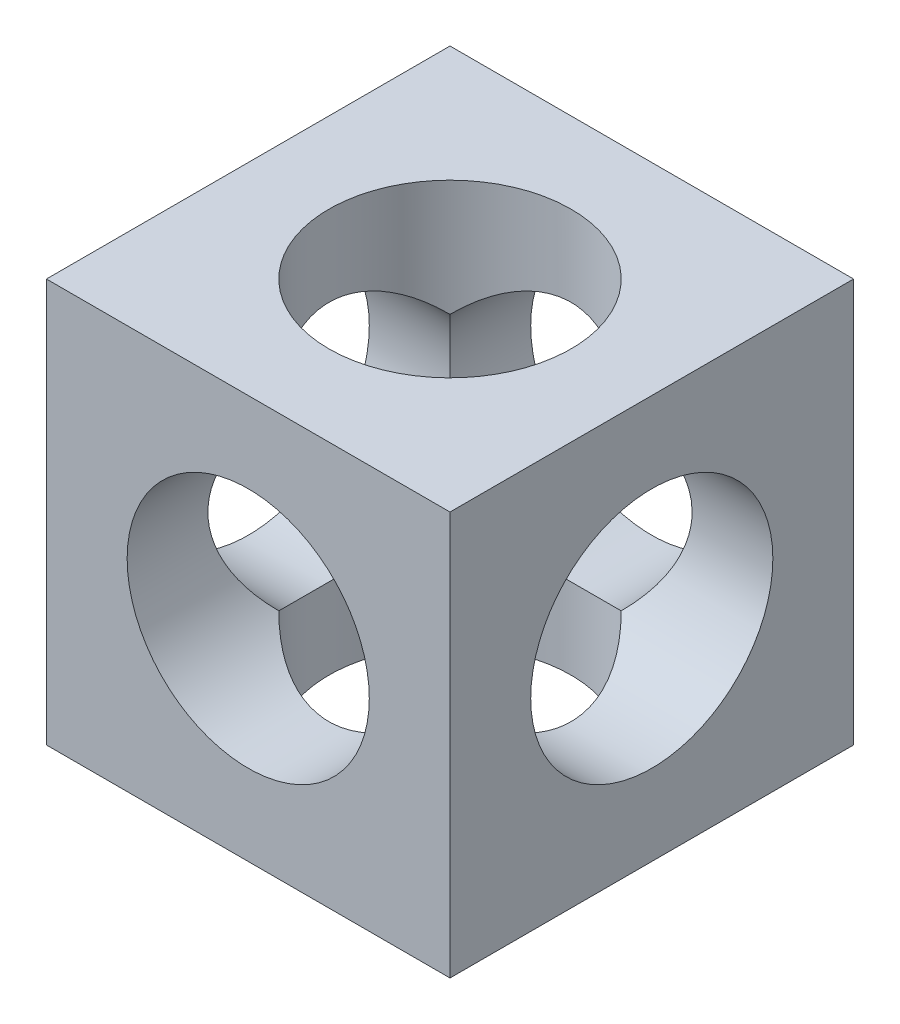
from build123d import *

# Parameters (mm, degrees)
SKETCH_1_W          = 5
SKETCH_1_H          = 5
SKETCH_1_R          = 1.5
EXTRUDE_1_DEPTH     = 5
SKETCH_2_R          = 1.5
CUT_EXTRUDE_1_DEPTH = 5
SKETCH_3_R          = 1.5
CUT_EXTRUDE_2_DEPTH = 5


with BuildPart() as part:
    # 草图1 → 凸台-拉伸1 (new body)
    with BuildSketch(Plane(origin=(0, 0, 0), x_dir=(1, 0, 0), z_dir=(0, 1, 0))):
        with Locations((2.5, 2.5)):
            Rectangle(SKETCH_1_W, SKETCH_1_H)
        with Locations(Location((2.5, 2.5, 0), (0, 0, 270))):
            Circle(SKETCH_1_R, mode=Mode.SUBTRACT)
    extrude(amount=EXTRUDE_1_DEPTH)

    # 草图2 → 切除-拉伸1 (cut)
    with BuildSketch(Plane.XY):
        with Locations((2.5, 2.5)):
            Circle(SKETCH_2_R)
    extrude(amount=-CUT_EXTRUDE_1_DEPTH, mode=Mode.SUBTRACT)

    # 草图3 → 切除-拉伸2 (cut)
    with BuildSketch(Plane(origin=(5, 0, 0), x_dir=(0, 0, -1), z_dir=(1, 0, 0))):
        with Locations((2.5, 2.5)):
            Circle(SKETCH_3_R)
    extrude(amount=-CUT_EXTRUDE_2_DEPTH, mode=Mode.SUBTRACT)


solid = part.part
